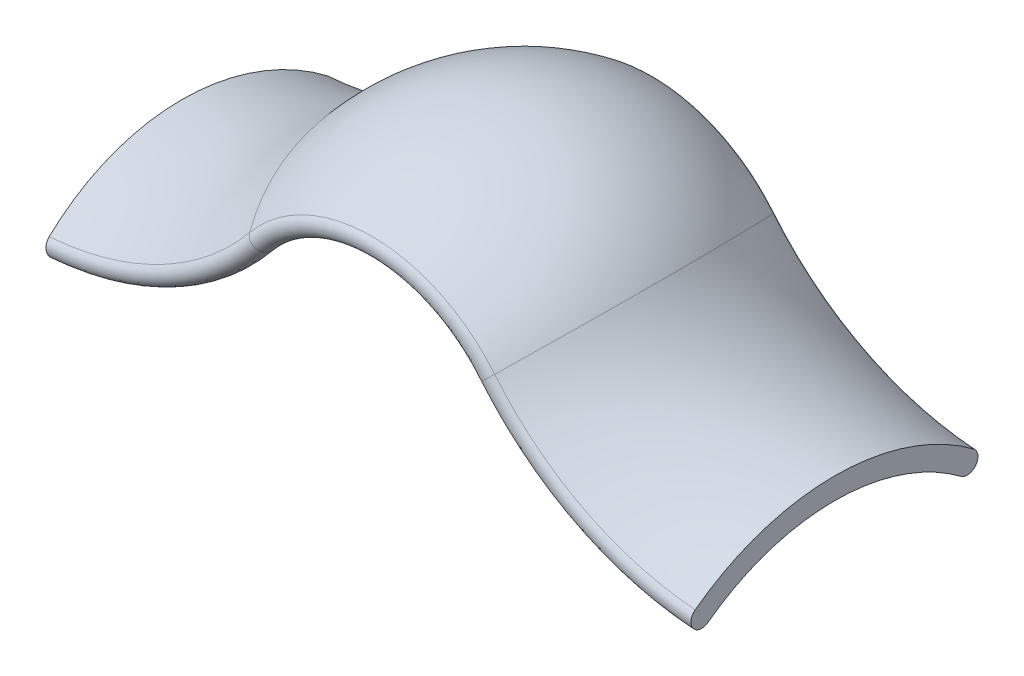
from build123d import *


with BuildPart() as part:
    # Sweep1: sweep along a path in Sketch4
    with BuildLine(Plane.XY) as sweep1_path:
        ThreePointArc((0, 0), (-12.933123295, 3.638699735), (-23.377708341, 12.089525561))
        ThreePointArc((-23.377708341, 12.089525561), (-38.1, 19.05), (-52.822291659, 12.089525561))
        ThreePointArc((-52.822291659, 12.089525561), (-63.266876705, 3.638699735), (-76.2, 0))
    # Sketch2 → Sweep1 (sweep)
    with BuildSketch(Plane(origin=(0, 0, 0), x_dir=(0, 0, -1), z_dir=(1, 0, 0))):
        with BuildLine():
            ThreePointArc((14.885260382, -2.399980647), (0, 2.544792821), (-14.885260382, -2.399980647))
            ThreePointArc((-14.885260382, -2.399980647), (-16.662734914, -2.14232916), (-16.405083427, -0.364854628))
            ThreePointArc((-16.405083427, -0.364854628), (0, 5.084792821), (16.405083427, -0.364854628))
            ThreePointArc((16.405083427, -0.364854628), (16.662734914, -2.14232916), (14.885260382, -2.399980647))
        make_face()
    sweep(path=sweep1_path.line)


solid = part.part
